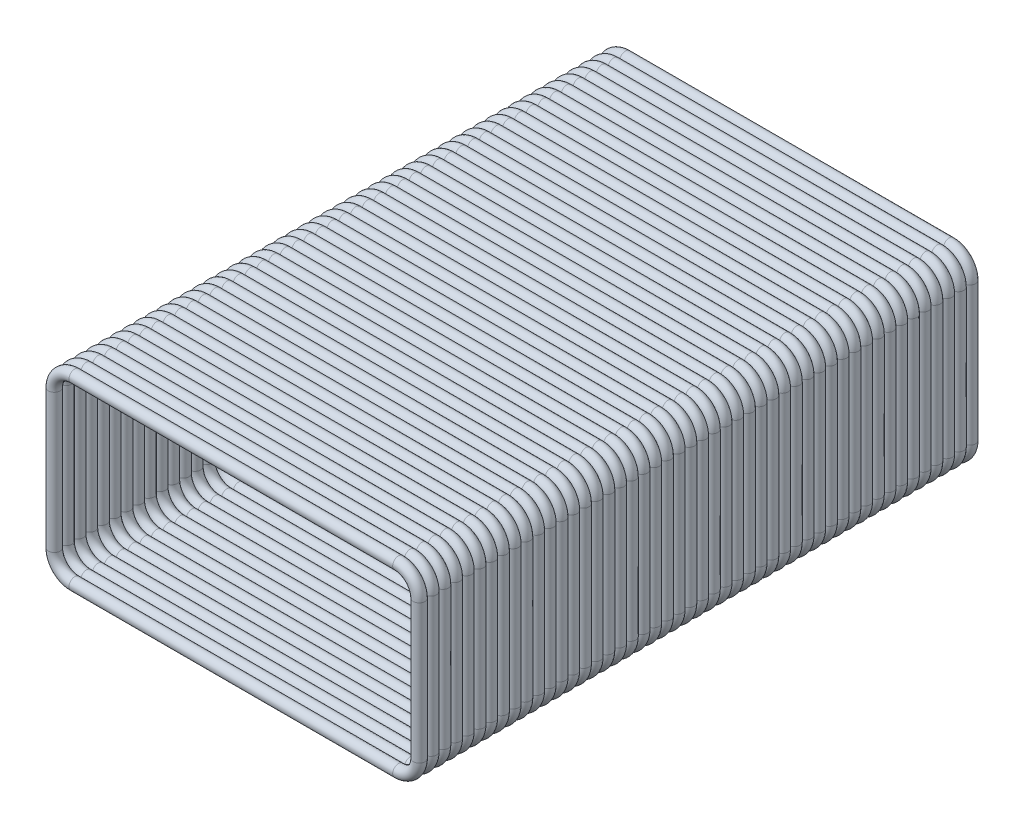
from build123d import *

# Parameters (mm, degrees)
SWEEP1_PROFILE_R = 0.57
LPATTERN1_COUNT  = 48
LPATTERN1_PITCH  = 1.14


with BuildPart() as part:
    # Sweep1: sweep along a path in Sketch1
    with BuildLine(Plane.XY) as sweep1_path:
        Line((-15.75, -8.75), (15.75, -8.75))
        ThreePointArc((15.75, -8.75), (17.164213562, -8.164213562), (17.75, -6.75))
        Line((17.75, -6.75), (17.75, 6.75))
        ThreePointArc((17.75, 6.75), (17.164213562, 8.164213562), (15.75, 8.75))
        Line((15.75, 8.75), (-15.75, 8.75))
        ThreePointArc((-15.75, 8.75), (-17.164213562, 8.164213562), (-17.75, 6.75))
        Line((-17.75, 6.75), (-17.75, -6.75))
        ThreePointArc((-17.75, -6.75), (-17.164213562, -8.164213562), (-15.75, -8.75))
    # Sweep1 profile (on start of the path) → Sweep1 (sweep)
    with BuildSketch(Plane(origin=(-15.75, -8.75, 0), x_dir=(0, 0, 1), z_dir=(1, 0, 0))):
        Circle(SWEEP1_PROFILE_R)
    sweep(path=sweep1_path.line)


with BuildPart() as lpattern1_1:
    # LPattern1: pattern copy
    add(part.part.moved(Location(Vector(0, 0, 1) * (1 * LPATTERN1_PITCH))))


with BuildPart() as lpattern1_2:
    # LPattern1: pattern copy
    add(part.part.moved(Location(Vector(0, 0, 1) * (2 * LPATTERN1_PITCH))))


with BuildPart() as lpattern1_3:
    # LPattern1: pattern copy
    add(part.part.moved(Location(Vector(0, 0, 1) * (3 * LPATTERN1_PITCH))))


with BuildPart() as lpattern1_4:
    # LPattern1: pattern copy
    add(part.part.moved(Location(Vector(0, 0, 1) * (4 * LPATTERN1_PITCH))))


with BuildPart() as lpattern1_5:
    # LPattern1: pattern copy
    add(part.part.moved(Location(Vector(0, 0, 1) * (5 * LPATTERN1_PITCH))))


with BuildPart() as lpattern1_6:
    # LPattern1: pattern copy
    add(part.part.moved(Location(Vector(0, 0, 1) * (6 * LPATTERN1_PITCH))))


with BuildPart() as lpattern1_7:
    # LPattern1: pattern copy
    add(part.part.moved(Location(Vector(0, 0, 1) * (7 * LPATTERN1_PITCH))))


with BuildPart() as lpattern1_8:
    # LPattern1: pattern copy
    add(part.part.moved(Location(Vector(0, 0, 1) * (8 * LPATTERN1_PITCH))))


with BuildPart() as lpattern1_9:
    # LPattern1: pattern copy
    add(part.part.moved(Location(Vector(0, 0, 1) * (9 * LPATTERN1_PITCH))))


with BuildPart() as lpattern1_10:
    # LPattern1: pattern copy
    add(part.part.moved(Location(Vector(0, 0, 1) * (10 * LPATTERN1_PITCH))))


with BuildPart() as lpattern1_11:
    # LPattern1: pattern copy
    add(part.part.moved(Location(Vector(0, 0, 1) * (11 * LPATTERN1_PITCH))))


with BuildPart() as lpattern1_12:
    # LPattern1: pattern copy
    add(part.part.moved(Location(Vector(0, 0, 1) * (12 * LPATTERN1_PITCH))))


with BuildPart() as lpattern1_13:
    # LPattern1: pattern copy
    add(part.part.moved(Location(Vector(0, 0, 1) * (13 * LPATTERN1_PITCH))))


with BuildPart() as lpattern1_14:
    # LPattern1: pattern copy
    add(part.part.moved(Location(Vector(0, 0, 1) * (14 * LPATTERN1_PITCH))))


with BuildPart() as lpattern1_15:
    # LPattern1: pattern copy
    add(part.part.moved(Location(Vector(0, 0, 1) * (15 * LPATTERN1_PITCH))))


with BuildPart() as lpattern1_16:
    # LPattern1: pattern copy
    add(part.part.moved(Location(Vector(0, 0, 1) * (16 * LPATTERN1_PITCH))))


with BuildPart() as lpattern1_17:
    # LPattern1: pattern copy
    add(part.part.moved(Location(Vector(0, 0, 1) * (17 * LPATTERN1_PITCH))))


with BuildPart() as lpattern1_18:
    # LPattern1: pattern copy
    add(part.part.moved(Location(Vector(0, 0, 1) * (18 * LPATTERN1_PITCH))))


with BuildPart() as lpattern1_19:
    # LPattern1: pattern copy
    add(part.part.moved(Location(Vector(0, 0, 1) * (19 * LPATTERN1_PITCH))))


with BuildPart() as lpattern1_20:
    # LPattern1: pattern copy
    add(part.part.moved(Location(Vector(0, 0, 1) * (20 * LPATTERN1_PITCH))))


with BuildPart() as lpattern1_21:
    # LPattern1: pattern copy
    add(part.part.moved(Location(Vector(0, 0, 1) * (21 * LPATTERN1_PITCH))))


with BuildPart() as lpattern1_22:
    # LPattern1: pattern copy
    add(part.part.moved(Location(Vector(0, 0, 1) * (22 * LPATTERN1_PITCH))))


with BuildPart() as lpattern1_23:
    # LPattern1: pattern copy
    add(part.part.moved(Location(Vector(0, 0, 1) * (23 * LPATTERN1_PITCH))))


with BuildPart() as lpattern1_24:
    # LPattern1: pattern copy
    add(part.part.moved(Location(Vector(0, 0, 1) * (24 * LPATTERN1_PITCH))))


with BuildPart() as lpattern1_25:
    # LPattern1: pattern copy
    add(part.part.moved(Location(Vector(0, 0, 1) * (25 * LPATTERN1_PITCH))))


with BuildPart() as lpattern1_26:
    # LPattern1: pattern copy
    add(part.part.moved(Location(Vector(0, 0, 1) * (26 * LPATTERN1_PITCH))))


with BuildPart() as lpattern1_27:
    # LPattern1: pattern copy
    add(part.part.moved(Location(Vector(0, 0, 1) * (27 * LPATTERN1_PITCH))))


with BuildPart() as lpattern1_28:
    # LPattern1: pattern copy
    add(part.part.moved(Location(Vector(0, 0, 1) * (28 * LPATTERN1_PITCH))))


with BuildPart() as lpattern1_29:
    # LPattern1: pattern copy
    add(part.part.moved(Location(Vector(0, 0, 1) * (29 * LPATTERN1_PITCH))))


with BuildPart() as lpattern1_30:
    # LPattern1: pattern copy
    add(part.part.moved(Location(Vector(0, 0, 1) * (30 * LPATTERN1_PITCH))))


with BuildPart() as lpattern1_31:
    # LPattern1: pattern copy
    add(part.part.moved(Location(Vector(0, 0, 1) * (31 * LPATTERN1_PITCH))))


with BuildPart() as lpattern1_32:
    # LPattern1: pattern copy
    add(part.part.moved(Location(Vector(0, 0, 1) * (32 * LPATTERN1_PITCH))))


with BuildPart() as lpattern1_33:
    # LPattern1: pattern copy
    add(part.part.moved(Location(Vector(0, 0, 1) * (33 * LPATTERN1_PITCH))))


with BuildPart() as lpattern1_34:
    # LPattern1: pattern copy
    add(part.part.moved(Location(Vector(0, 0, 1) * (34 * LPATTERN1_PITCH))))


with BuildPart() as lpattern1_35:
    # LPattern1: pattern copy
    add(part.part.moved(Location(Vector(0, 0, 1) * (35 * LPATTERN1_PITCH))))


with BuildPart() as lpattern1_36:
    # LPattern1: pattern copy
    add(part.part.moved(Location(Vector(0, 0, 1) * (36 * LPATTERN1_PITCH))))


with BuildPart() as lpattern1_37:
    # LPattern1: pattern copy
    add(part.part.moved(Location(Vector(0, 0, 1) * (37 * LPATTERN1_PITCH))))


with BuildPart() as lpattern1_38:
    # LPattern1: pattern copy
    add(part.part.moved(Location(Vector(0, 0, 1) * (38 * LPATTERN1_PITCH))))


with BuildPart() as lpattern1_39:
    # LPattern1: pattern copy
    add(part.part.moved(Location(Vector(0, 0, 1) * (39 * LPATTERN1_PITCH))))


with BuildPart() as lpattern1_40:
    # LPattern1: pattern copy
    add(part.part.moved(Location(Vector(0, 0, 1) * (40 * LPATTERN1_PITCH))))


with BuildPart() as lpattern1_41:
    # LPattern1: pattern copy
    add(part.part.moved(Location(Vector(0, 0, 1) * (41 * LPATTERN1_PITCH))))


with BuildPart() as lpattern1_42:
    # LPattern1: pattern copy
    add(part.part.moved(Location(Vector(0, 0, 1) * (42 * LPATTERN1_PITCH))))


with BuildPart() as lpattern1_43:
    # LPattern1: pattern copy
    add(part.part.moved(Location(Vector(0, 0, 1) * (43 * LPATTERN1_PITCH))))


with BuildPart() as lpattern1_44:
    # LPattern1: pattern copy
    add(part.part.moved(Location(Vector(0, 0, 1) * (44 * LPATTERN1_PITCH))))


with BuildPart() as lpattern1_45:
    # LPattern1: pattern copy
    add(part.part.moved(Location(Vector(0, 0, 1) * (45 * LPATTERN1_PITCH))))


with BuildPart() as lpattern1_46:
    # LPattern1: pattern copy
    add(part.part.moved(Location(Vector(0, 0, 1) * (46 * LPATTERN1_PITCH))))


with BuildPart() as lpattern1_47:
    # LPattern1: pattern copy
    add(part.part.moved(Location(Vector(0, 0, 1) * (47 * LPATTERN1_PITCH))))


solid = Compound([part.part, lpattern1_1.part, lpattern1_2.part, lpattern1_3.part, lpattern1_4.part, lpattern1_5.part, lpattern1_6.part, lpattern1_7.part, lpattern1_8.part, lpattern1_9.part, lpattern1_10.part, lpattern1_11.part, lpattern1_12.part, lpattern1_13.part, lpattern1_14.part, lpattern1_15.part, lpattern1_16.part, lpattern1_17.part, lpattern1_18.part, lpattern1_19.part, lpattern1_20.part, lpattern1_21.part, lpattern1_22.part, lpattern1_23.part, lpattern1_24.part, lpattern1_25.part, lpattern1_26.part, lpattern1_27.part, lpattern1_28.part, lpattern1_29.part, lpattern1_30.part, lpattern1_31.part, lpattern1_32.part, lpattern1_33.part, lpattern1_34.part, lpattern1_35.part, lpattern1_36.part, lpattern1_37.part, lpattern1_38.part, lpattern1_39.part, lpattern1_40.part, lpattern1_41.part, lpattern1_42.part, lpattern1_43.part, lpattern1_44.part, lpattern1_45.part, lpattern1_46.part, lpattern1_47.part])
